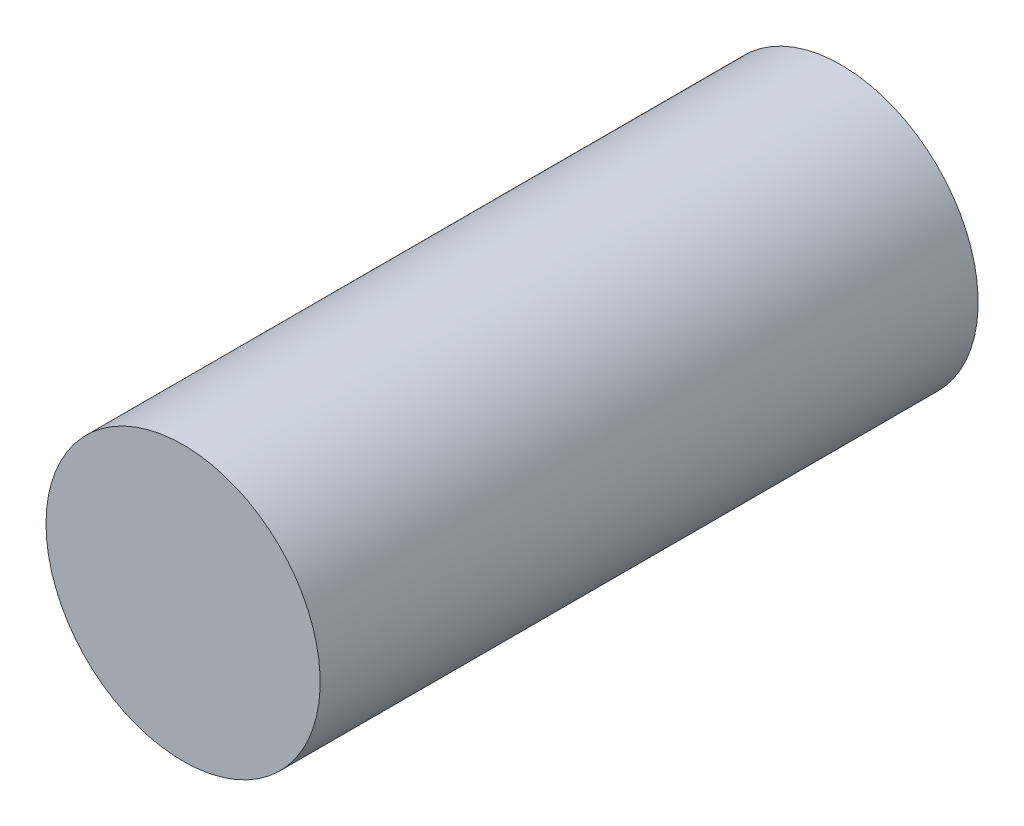
from build123d import *

# Parameters (mm, degrees)
SKETCH1_R           = 7.9375
BOSS_EXTRUDE1_DEPTH = 38.1


with BuildPart() as part:
    # Sketch1 → Boss-Extrude1 (new body)
    with BuildSketch(Plane.XY):
        with Locations(Location((0, 0, 0), (0, 0, 180))):
            Circle(SKETCH1_R)
    extrude(amount=BOSS_EXTRUDE1_DEPTH)


solid = part.part
